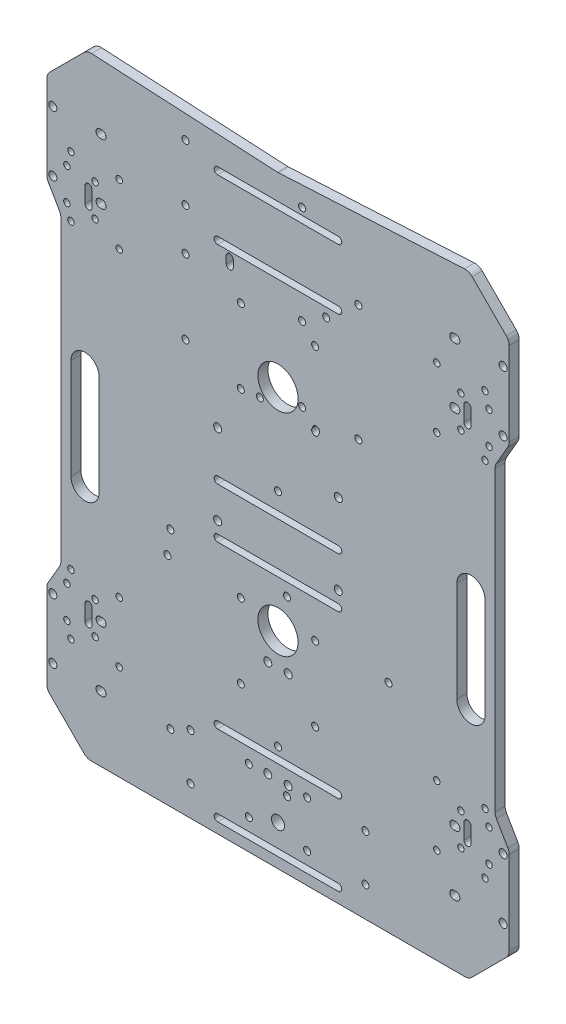
from build123d import *

# Parameters (mm, degrees)
F_5MM_DEPTH = 5


with BuildPart() as part:
    # 草图1 → 亚克力板厚5mm (new body)
    with BuildSketch(Plane.XY):
        with BuildLine():
            Line((113.535533906, -133.964466094), (96.464466094, -151.035533906))
            ThreePointArc((96.464466094, -151.035533906), (94.84234935, -152.119397663), (92.928932188, -152.5))
            Line((92.928932188, -152.5), (-92.928932188, -152.5))
            ThreePointArc((-92.928932188, -152.5), (-94.84234935, -152.119397663), (-96.464466094, -151.035533906))
            Line((-96.464466094, -151.035533906), (-113.535533906, -133.964466094))
            ThreePointArc((-113.535533906, -133.964466094), (-114.619397663, -132.34234935), (-115, -130.428932188))
            Line((-115, -130.428932188), (-115, -88.839745962))
            ThreePointArc((-115, -88.839745962), (-114.829629131, -87.545650737), (-114.330127019, -86.339745962))
            Line((-114.330127019, -86.339745962), (-108.669872981, -76.535898385))
            ThreePointArc((-108.669872981, -76.535898385), (-108.170370869, -75.32999361), (-108, -74.035898385))
            Line((-108, -74.035898385), (-108, 74.035898385))
            ThreePointArc((-108, 74.035898385), (-108.170370869, 75.32999361), (-108.669872981, 76.535898385))
            Line((-108.669872981, 76.535898385), (-114.330127019, 86.339745962))
            ThreePointArc((-114.330127019, 86.339745962), (-114.829629131, 87.545650737), (-115, 88.839745962))
            Line((-115, 88.839745962), (-115, 130.428932188))
            ThreePointArc((-115, 130.428932188), (-114.619397663, 132.34234935), (-113.535533906, 133.964466094))
            Line((-113.535533906, 133.964466094), (-96.574593882, 150.925406118))
            ThreePointArc((-96.574593882, 150.925406118), (-94.952477138, 152.009269874), (-93.039059976, 152.389872212))
            ThreePointArc((-93.039059976, 152.389872212), (-92.907617467, 152.3881442), (-92.776265811, 152.382961358))
            Line((-92.776265811, 152.382961358), (-0.262794166, 147.513831272))
            ThreePointArc((-0.262794166, 147.513831272), (-0.13144251, 147.50864843), (0, 147.506920418))
            ThreePointArc((0, 147.506920418), (0.13144251, 147.50864843), (0.262794166, 147.513831272))
            Line((0.262794166, 147.513831272), (92.776265811, 152.382961358))
            ThreePointArc((92.776265811, 152.382961358), (94.830378812, 152.05797427), (96.574593882, 150.925406118))
            Line((96.574593882, 150.925406118), (113.535533906, 133.964466094))
            ThreePointArc((113.535533906, 133.964466094), (114.619397663, 132.34234935), (115, 130.428932188))
            Line((115, 130.428932188), (115, 88.839745962))
            ThreePointArc((115, 88.839745962), (114.829629131, 87.545650737), (114.330127019, 86.339745962))
            Line((114.330127019, 86.339745962), (108.669872981, 76.535898385))
            ThreePointArc((108.669872981, 76.535898385), (108.170370869, 75.32999361), (108, 74.035898385))
            Line((108, 74.035898385), (108, -74.035898385))
            ThreePointArc((108, -74.035898385), (108.170370869, -75.32999361), (108.669872981, -76.535898385))
            Line((108.669872981, -76.535898385), (114.330127019, -86.339745962))
            ThreePointArc((114.330127019, -86.339745962), (114.829629131, -87.545650737), (115, -88.839745962))
            Line((115, -88.839745962), (115, -130.428932188))
            ThreePointArc((115, -130.428932188), (114.619397663, -132.34234935), (113.535533906, -133.964466094))
        make_face()
        with BuildLine():
            Line((87.5, -88), (88.5, -88))
            ThreePointArc((88.5, -88), (90.5, -90), (88.5, -92))
            Line((88.5, -92), (87.5, -92))
            ThreePointArc((87.5, -92), (85.5, -90), (87.5, -88))
        make_face(mode=Mode.SUBTRACT)
        with BuildLine():
            Line((87.5, -118), (88.5, -118))
            ThreePointArc((88.5, -118), (90.5, -120), (88.5, -122))
            Line((88.5, -122), (87.5, -122))
            ThreePointArc((87.5, -122), (85.5, -120), (87.5, -118))
        make_face(mode=Mode.SUBTRACT)
        with BuildLine():
            Line((-87.5, -88), (-88.5, -88))
            ThreePointArc((-88.5, -88), (-90.5, -90), (-88.5, -92))
            Line((-88.5, -92), (-87.5, -92))
            ThreePointArc((-87.5, -92), (-85.5, -90), (-87.5, -88))
        make_face(mode=Mode.SUBTRACT)
        with BuildLine():
            Line((-87.5, -118), (-88.5, -118))
            ThreePointArc((-88.5, -118), (-90.5, -120), (-88.5, -122))
            Line((-88.5, -122), (-87.5, -122))
            ThreePointArc((-87.5, -122), (-85.5, -120), (-87.5, -118))
        make_face(mode=Mode.SUBTRACT)
        with BuildLine():
            Line((-87.5, 88), (-88.5, 88))
            ThreePointArc((-88.5, 88), (-90.5, 90), (-88.5, 92))
            Line((-88.5, 92), (-87.5, 92))
            ThreePointArc((-87.5, 92), (-85.5, 90), (-87.5, 88))
        make_face(mode=Mode.SUBTRACT)
        with BuildLine():
            Line((-87.5, 118), (-88.5, 118))
            ThreePointArc((-88.5, 118), (-90.5, 120), (-88.5, 122))
            Line((-88.5, 122), (-87.5, 122))
            ThreePointArc((-87.5, 122), (-85.5, 120), (-87.5, 118))
        make_face(mode=Mode.SUBTRACT)
        with BuildLine():
            Line((30, -26.75), (-30, -26.75))
            ThreePointArc((-30, -26.75), (-31.75, -25), (-30, -23.25))
            Line((-30, -23.25), (30, -23.25))
            ThreePointArc((30, -23.25), (31.75, -25), (30, -26.75))
        make_face(mode=Mode.SUBTRACT)
        with BuildLine():
            Line((30, 131.5), (-30, 131.5))
            ThreePointArc((-30, 131.5), (-31.75, 133.25), (-30, 135))
            Line((-30, 135), (30, 135))
            ThreePointArc((30, 135), (31.75, 133.25), (30, 131.5))
        make_face(mode=Mode.SUBTRACT)
        with BuildLine():
            Line((30, -147.25), (-30, -147.25))
            ThreePointArc((-30, -147.25), (-31.75, -145.5), (-30, -143.75))
            Line((-30, -143.75), (30, -143.75))
            ThreePointArc((30, -143.75), (31.75, -145.5), (30, -147.25))
        make_face(mode=Mode.SUBTRACT)
        with BuildLine():
            Line((30, 101.5), (-30, 101.5))
            ThreePointArc((-30, 101.5), (-31.75, 103.25), (-30, 105))
            Line((-30, 105), (30, 105))
            ThreePointArc((30, 105), (31.75, 103.25), (30, 101.5))
        make_face(mode=Mode.SUBTRACT)
        with BuildLine():
            Line((30, -1.75), (-30, -1.75))
            ThreePointArc((-30, -1.75), (-31.75, 0), (-30, 1.75))
            Line((-30, 1.75), (30, 1.75))
            ThreePointArc((30, 1.75), (31.75, 0), (30, -1.75))
        make_face(mode=Mode.SUBTRACT)
        with BuildLine():
            Line((30, -107.25), (-30, -107.25))
            ThreePointArc((-30, -107.25), (-31.75, -105.5), (-30, -103.75))
            Line((-30, -103.75), (30, -103.75))
            ThreePointArc((30, -103.75), (31.75, -105.5), (30, -107.25))
        make_face(mode=Mode.SUBTRACT)
        with BuildLine():
            Line((-25.75, 95.30797427), (-25.75, 98.80797427))
            ThreePointArc((-25.75, 98.80797427), (-25.237436867, 100.045411137), (-24, 100.55797427))
            ThreePointArc((-24, 100.55797427), (-22.762563133, 100.045411137), (-22.25, 98.80797427))
            Line((-22.25, 98.80797427), (-22.25, 95.30797427))
            ThreePointArc((-22.25, 95.30797427), (-24, 93.55797427), (-25.75, 95.30797427))
        make_face(mode=Mode.SUBTRACT)
        with BuildLine():
            Line((-89, 15), (-89, -35))
            ThreePointArc((-89, -35), (-96, -42), (-103, -35))
            Line((-103, -35), (-103, 15))
            ThreePointArc((-103, 15), (-100.949747468, 19.949747468), (-96, 22))
            ThreePointArc((-96, 22), (-91.050252532, 19.949747468), (-89, 15))
        make_face(mode=Mode.SUBTRACT)
        with BuildLine():
            Line((-96, -86.1), (-96, -93.9))
            ThreePointArc((-96, -93.9), (-94.25, -95.65), (-92.5, -93.9))
            Line((-92.5, -93.9), (-92.5, -86.1))
            ThreePointArc((-92.5, -86.1), (-93.012563133, -84.862563133), (-94.25, -84.35))
            ThreePointArc((-94.25, -84.35), (-95.487436867, -84.862563133), (-96, -86.1))
        make_face(mode=Mode.SUBTRACT)
        with BuildLine():
            Line((-96, 93.9), (-96, 86.1))
            ThreePointArc((-96, 86.1), (-94.25, 84.35), (-92.5, 86.1))
            Line((-92.5, 86.1), (-92.5, 93.9))
            ThreePointArc((-92.5, 93.9), (-93.012563133, 95.137436867), (-94.25, 95.65))
            ThreePointArc((-94.25, 95.65), (-95.487436867, 95.137436867), (-96, 93.9))
        make_face(mode=Mode.SUBTRACT)
        with BuildLine():
            Line((96, -86.1), (96, -93.9))
            ThreePointArc((96, -93.9), (94.25, -95.65), (92.5, -93.9))
            Line((92.5, -93.9), (92.5, -86.1))
            ThreePointArc((92.5, -86.1), (93.012563133, -84.862563133), (94.25, -84.35))
            ThreePointArc((94.25, -84.35), (95.487436867, -84.862563133), (96, -86.1))
        make_face(mode=Mode.SUBTRACT)
        with BuildLine():
            Line((96, 93.9), (96, 86.1))
            ThreePointArc((96, 86.1), (94.25, 84.35), (92.5, 86.1))
            Line((92.5, 86.1), (92.5, 93.9))
            ThreePointArc((92.5, 93.9), (93.012563133, 95.137436867), (94.25, 95.65))
            ThreePointArc((94.25, 95.65), (95.487436867, 95.137436867), (96, 93.9))
        make_face(mode=Mode.SUBTRACT)
        with BuildLine():
            Line((89, 15), (89, -35))
            ThreePointArc((89, -35), (96, -42), (103, -35))
            Line((103, -35), (103, 15))
            ThreePointArc((103, 15), (100.949747468, 19.949747468), (96, 22))
            ThreePointArc((96, 22), (91.050252532, 19.949747468), (89, 15))
        make_face(mode=Mode.SUBTRACT)
        with BuildLine():
            Line((87.5, 118), (88.5, 118))
            ThreePointArc((88.5, 118), (90.5, 120), (88.5, 122))
            Line((88.5, 122), (87.5, 122))
            ThreePointArc((87.5, 122), (85.5, 120), (87.5, 118))
        make_face(mode=Mode.SUBTRACT)
        with BuildLine():
            Line((87.5, 88), (88.5, 88))
            ThreePointArc((88.5, 88), (90.5, 90), (88.5, 92))
            Line((88.5, 92), (87.5, 92))
            ThreePointArc((87.5, 92), (85.5, 90), (87.5, 88))
        make_face(mode=Mode.SUBTRACT)
        with BuildLine():
            ThreePointArc((112, -118), (114, -120), (112, -122))
            ThreePointArc((112, -122), (110, -120), (112, -118))
        make_face(mode=Mode.SUBTRACT)
        with BuildLine():
            ThreePointArc((112, -88), (114, -90), (112, -92))
            ThreePointArc((112, -92), (110, -90), (112, -88))
        make_face(mode=Mode.SUBTRACT)
        with BuildLine():
            ThreePointArc((112, 122), (110, 120), (112, 118))
            ThreePointArc((112, 118), (114, 120), (112, 122))
        make_face(mode=Mode.SUBTRACT)
        with BuildLine():
            ThreePointArc((112, 92), (110, 90), (112, 88))
            ThreePointArc((112, 88), (114, 90), (112, 92))
        make_face(mode=Mode.SUBTRACT)
        with BuildLine():
            ThreePointArc((-112, 122), (-110, 120), (-112, 118))
            ThreePointArc((-112, 118), (-114, 120), (-112, 122))
        make_face(mode=Mode.SUBTRACT)
        with BuildLine():
            ThreePointArc((-112, 92), (-110, 90), (-112, 88))
            ThreePointArc((-112, 88), (-114, 90), (-112, 92))
        make_face(mode=Mode.SUBTRACT)
        with BuildLine():
            ThreePointArc((0, -129.25), (3.25, -132.5), (0, -135.75))
            ThreePointArc((0, -135.75), (-3.25, -132.5), (0, -129.25))
        make_face(mode=Mode.SUBTRACT)
        with BuildLine():
            ThreePointArc((55, -43.08), (56.75, -44.83), (55, -46.58))
            ThreePointArc((55, -46.58), (53.25, -44.83), (55, -43.08))
        make_face(mode=Mode.SUBTRACT)
        with BuildLine():
            ThreePointArc((0, 11.92), (1.75, 10.17), (0, 8.42))
            ThreePointArc((0, 8.42), (-1.75, 10.17), (0, 11.92))
        make_face(mode=Mode.SUBTRACT)
        with BuildLine():
            ThreePointArc((-55, -43.08), (-53.25, -44.83), (-55, -46.58))
            ThreePointArc((-55, -46.58), (-56.75, -44.83), (-55, -43.08))
        make_face(mode=Mode.SUBTRACT)
        with BuildLine():
            ThreePointArc((5.075, -63.9), (7.075, -65.9), (5.075, -67.9))
            ThreePointArc((5.075, -67.9), (3.075, -65.9), (5.075, -63.9))
        make_face(mode=Mode.SUBTRACT)
        with BuildLine():
            ThreePointArc((-5.075, -63.9), (-3.075, -65.9), (-5.075, -67.9))
            ThreePointArc((-5.075, -67.9), (-7.075, -65.9), (-5.075, -63.9))
        make_face(mode=Mode.SUBTRACT)
        with BuildLine():
            ThreePointArc((-5.075, -112.1), (-3.075, -114.1), (-5.075, -116.1))
            ThreePointArc((-5.075, -116.1), (-7.075, -114.1), (-5.075, -112.1))
        make_face(mode=Mode.SUBTRACT)
        with BuildLine():
            ThreePointArc((5.075, -112.1), (7.075, -114.1), (5.075, -116.1))
            ThreePointArc((5.075, -116.1), (3.075, -114.1), (5.075, -112.1))
        make_face(mode=Mode.SUBTRACT)
        with BuildLine():
            ThreePointArc((0, -98.08), (1.75, -99.83), (0, -101.58))
            ThreePointArc((0, -101.58), (-1.75, -99.83), (0, -98.08))
        make_face(mode=Mode.SUBTRACT)
        with BuildLine():
            ThreePointArc((-43.5, -112.75), (-41.75, -114.5), (-43.5, -116.25))
            ThreePointArc((-43.5, -116.25), (-45.25, -114.5), (-43.5, -112.75))
        make_face(mode=Mode.SUBTRACT)
        with BuildLine():
            ThreePointArc((43.5, -112.75), (45.25, -114.5), (43.5, -116.25))
            ThreePointArc((43.5, -116.25), (41.75, -114.5), (43.5, -112.75))
        make_face(mode=Mode.SUBTRACT)
        with BuildLine():
            ThreePointArc((-43.5, -135.75), (-41.75, -137.5), (-43.5, -139.25))
            ThreePointArc((-43.5, -139.25), (-45.25, -137.5), (-43.5, -135.75))
        make_face(mode=Mode.SUBTRACT)
        with BuildLine():
            ThreePointArc((43.5, -135.75), (45.25, -137.5), (43.5, -139.25))
            ThreePointArc((43.5, -139.25), (41.75, -137.5), (43.5, -135.75))
        make_face(mode=Mode.SUBTRACT)
        with BuildLine():
            ThreePointArc((14.5, -135.75), (16.25, -137.5), (14.5, -139.25))
            ThreePointArc((14.5, -139.25), (12.75, -137.5), (14.5, -135.75))
        make_face(mode=Mode.SUBTRACT)
        with BuildLine():
            ThreePointArc((-14.5, -112.75), (-12.75, -114.5), (-14.5, -116.25))
            ThreePointArc((-14.5, -116.25), (-16.25, -114.5), (-14.5, -112.75))
        make_face(mode=Mode.SUBTRACT)
        with BuildLine():
            ThreePointArc((14.5, -112.75), (16.25, -114.5), (14.5, -116.25))
            ThreePointArc((14.5, -116.25), (12.75, -114.5), (14.5, -112.75))
        make_face(mode=Mode.SUBTRACT)
        with BuildLine():
            ThreePointArc((-14.5, -135.75), (-12.75, -137.5), (-14.5, -139.25))
            ThreePointArc((-14.5, -139.25), (-16.25, -137.5), (-14.5, -135.75))
        make_face(mode=Mode.SUBTRACT)
        with BuildLine():
            ThreePointArc((-18.5, 80.25), (-20.25, 82), (-18.5, 83.75))
            ThreePointArc((-18.5, 83.75), (-16.75, 82), (-18.5, 80.25))
        make_face(mode=Mode.SUBTRACT)
        with BuildLine():
            ThreePointArc((-18.5, 43.25), (-20.25, 45), (-18.5, 46.75))
            ThreePointArc((-18.5, 46.75), (-16.75, 45), (-18.5, 43.25))
        make_face(mode=Mode.SUBTRACT)
        with BuildLine():
            ThreePointArc((18.5, 80.25), (16.75, 82), (18.5, 83.75))
            ThreePointArc((18.5, 83.75), (20.25, 82), (18.5, 80.25))
        make_face(mode=Mode.SUBTRACT)
        with BuildLine():
            ThreePointArc((-18.5, -83.75), (-16.75, -82), (-18.5, -80.25))
            ThreePointArc((-18.5, -80.25), (-20.25, -82), (-18.5, -83.75))
        make_face(mode=Mode.SUBTRACT)
        with BuildLine():
            ThreePointArc((18.5, -46.75), (20.25, -45), (18.5, -43.25))
            ThreePointArc((18.5, -43.25), (16.75, -45), (18.5, -46.75))
        make_face(mode=Mode.SUBTRACT)
        with BuildLine():
            ThreePointArc((-18.5, -46.75), (-16.75, -45), (-18.5, -43.25))
            ThreePointArc((-18.5, -43.25), (-20.25, -45), (-18.5, -46.75))
        make_face(mode=Mode.SUBTRACT)
        with BuildLine():
            ThreePointArc((18.5, -83.75), (20.25, -82), (18.5, -80.25))
            ThreePointArc((18.5, -80.25), (16.75, -82), (18.5, -83.75))
        make_face(mode=Mode.SUBTRACT)
        with BuildLine():
            ThreePointArc((17.258845931, 46.233708465), (17.826337962, 47.356056479), (19, 47.80797427))
            ThreePointArc((19, 47.80797427), (20.615779969, 46.73010156), (20.241154069, 44.824265805))
            ThreePointArc((20.241154069, 44.824265805), (19.673662038, 43.701917791), (18.5, 43.25))
            ThreePointArc((18.5, 43.25), (16.884220031, 44.327872711), (17.258845931, 46.233708465))
        make_face(mode=Mode.SUBTRACT)
        with BuildLine():
            ThreePointArc((-9, 47.80797427), (-7.25, 46.05797427), (-9, 44.30797427))
            ThreePointArc((-9, 44.30797427), (-10.75, 46.05797427), (-9, 47.80797427))
        make_face(mode=Mode.SUBTRACT)
        with BuildLine():
            ThreePointArc((24, 98.80797427), (25.75, 97.05797427), (24, 95.30797427))
            ThreePointArc((24, 95.30797427), (22.25, 97.05797427), (24, 98.80797427))
        make_face(mode=Mode.SUBTRACT)
        with BuildLine():
            ThreePointArc((0, -60), (10, -50), (0, -40))
            ThreePointArc((0, -40), (-10, -50), (0, -60))
        make_face(mode=Mode.SUBTRACT)
        with BuildLine():
            ThreePointArc((0, 45), (10, 55), (0, 65))
            ThreePointArc((0, 65), (-10, 55), (0, 45))
        make_face(mode=Mode.SUBTRACT)
        with BuildLine():
            ThreePointArc((-53.5, -31.25), (-51.75, -33), (-53.5, -34.75))
            ThreePointArc((-53.5, -34.75), (-55.25, -33), (-53.5, -31.25))
        make_face(mode=Mode.SUBTRACT)
        with BuildLine():
            ThreePointArc((4.5, -31.25), (6.25, -33), (4.5, -34.75))
            ThreePointArc((4.5, -34.75), (2.75, -33), (4.5, -31.25))
        make_face(mode=Mode.SUBTRACT)
        with BuildLine():
            ThreePointArc((4.5, -117.25), (6.25, -119), (4.5, -120.75))
            ThreePointArc((4.5, -120.75), (2.75, -119), (4.5, -117.25))
        make_face(mode=Mode.SUBTRACT)
        with BuildLine():
            ThreePointArc((-53.5, -117.25), (-51.75, -119), (-53.5, -120.75))
            ThreePointArc((-53.5, -120.75), (-55.25, -119), (-53.5, -117.25))
        make_face(mode=Mode.SUBTRACT)
        with BuildLine():
            ThreePointArc((12, 91.25), (13.75, 89.5), (12, 87.75))
            ThreePointArc((12, 87.75), (10.25, 89.5), (12, 91.25))
        make_face(mode=Mode.SUBTRACT)
        with BuildLine():
            ThreePointArc((-46, 91.25), (-44.25, 89.5), (-46, 87.75))
            ThreePointArc((-46, 87.75), (-47.75, 89.5), (-46, 91.25))
        make_face(mode=Mode.SUBTRACT)
        with BuildLine():
            ThreePointArc((12, 140.25), (13.75, 138.5), (12, 136.75))
            ThreePointArc((12, 136.75), (10.25, 138.5), (12, 140.25))
        make_face(mode=Mode.SUBTRACT)
        with BuildLine():
            ThreePointArc((-46, 140.25), (-44.25, 138.5), (-46, 136.75))
            ThreePointArc((-46, 136.75), (-47.75, 138.5), (-46, 140.25))
        make_face(mode=Mode.SUBTRACT)
        with BuildLine():
            ThreePointArc((40, 54.25), (41.75, 52.5), (40, 50.75))
            ThreePointArc((40, 50.75), (38.25, 52.5), (40, 54.25))
        make_face(mode=Mode.SUBTRACT)
        with BuildLine():
            ThreePointArc((-46, 112.25), (-44.25, 110.5), (-46, 108.75))
            ThreePointArc((-46, 108.75), (-47.75, 110.5), (-46, 112.25))
        make_face(mode=Mode.SUBTRACT)
        with BuildLine():
            ThreePointArc((40, 112.25), (41.75, 110.5), (40, 108.75))
            ThreePointArc((40, 108.75), (38.25, 110.5), (40, 112.25))
        make_face(mode=Mode.SUBTRACT)
        with BuildLine():
            ThreePointArc((12, 54.25), (13.75, 52.5), (12, 50.75))
            ThreePointArc((12, 50.75), (10.25, 52.5), (12, 54.25))
        make_face(mode=Mode.SUBTRACT)
        with BuildLine():
            ThreePointArc((-46, 54.25), (-44.25, 52.5), (-46, 50.75))
            ThreePointArc((-46, 50.75), (-47.75, 52.5), (-46, 54.25))
        make_face(mode=Mode.SUBTRACT)
        with BuildLine():
            ThreePointArc((30, -15.5), (32, -17.5), (30, -19.5))
            ThreePointArc((30, -19.5), (28, -17.5), (30, -15.5))
        make_face(mode=Mode.SUBTRACT)
        with BuildLine():
            ThreePointArc((-30, 24.5), (-28, 22.5), (-30, 20.5))
            ThreePointArc((-30, 20.5), (-32, 22.5), (-30, 24.5))
        make_face(mode=Mode.SUBTRACT)
        with BuildLine():
            ThreePointArc((30, 24.5), (32, 22.5), (30, 20.5))
            ThreePointArc((30, 20.5), (28, 22.5), (30, 24.5))
        make_face(mode=Mode.SUBTRACT)
        with BuildLine():
            ThreePointArc((-30, -15.5), (-28, -17.5), (-30, -19.5))
            ThreePointArc((-30, -19.5), (-32, -17.5), (-30, -15.5))
        make_face(mode=Mode.SUBTRACT)
        with BuildLine():
            ThreePointArc((-91, -96.4), (-92.6, -98), (-91, -99.6))
            ThreePointArc((-91, -99.6), (-89.4, -98), (-91, -96.4))
        make_face(mode=Mode.SUBTRACT)
        with BuildLine():
            ThreePointArc((-91, -80.4), (-92.6, -82), (-91, -83.6))
            ThreePointArc((-91, -83.6), (-89.4, -82), (-91, -80.4))
        make_face(mode=Mode.SUBTRACT)
        with BuildLine():
            ThreePointArc((-105, -80.4), (-106.6, -82), (-105, -83.6))
            ThreePointArc((-105, -83.6), (-103.4, -82), (-105, -80.4))
        make_face(mode=Mode.SUBTRACT)
        with BuildLine():
            ThreePointArc((-79, -103.4), (-80.6, -105), (-79, -106.6))
            ThreePointArc((-79, -106.6), (-77.4, -105), (-79, -103.4))
        make_face(mode=Mode.SUBTRACT)
        with BuildLine():
            ThreePointArc((-103, -73.4), (-104.6, -75), (-103, -76.6))
            ThreePointArc((-103, -76.6), (-101.4, -75), (-103, -73.4))
        make_face(mode=Mode.SUBTRACT)
        with BuildLine():
            ThreePointArc((-103, -103.4), (-104.6, -105), (-103, -106.6))
            ThreePointArc((-103, -106.6), (-101.4, -105), (-103, -103.4))
        make_face(mode=Mode.SUBTRACT)
        with BuildLine():
            ThreePointArc((-105, -96.4), (-106.6, -98), (-105, -99.6))
            ThreePointArc((-105, -99.6), (-103.4, -98), (-105, -96.4))
        make_face(mode=Mode.SUBTRACT)
        with BuildLine():
            ThreePointArc((-79, -73.4), (-80.6, -75), (-79, -76.6))
            ThreePointArc((-79, -76.6), (-77.4, -75), (-79, -73.4))
        make_face(mode=Mode.SUBTRACT)
        with BuildLine():
            ThreePointArc((-91, 83.6), (-92.6, 82), (-91, 80.4))
            ThreePointArc((-91, 80.4), (-89.4, 82), (-91, 83.6))
        make_face(mode=Mode.SUBTRACT)
        with BuildLine():
            ThreePointArc((-91, 99.6), (-92.6, 98), (-91, 96.4))
            ThreePointArc((-91, 96.4), (-89.4, 98), (-91, 99.6))
        make_face(mode=Mode.SUBTRACT)
        with BuildLine():
            ThreePointArc((-105, 99.6), (-106.6, 98), (-105, 96.4))
            ThreePointArc((-105, 96.4), (-103.4, 98), (-105, 99.6))
        make_face(mode=Mode.SUBTRACT)
        with BuildLine():
            ThreePointArc((-79, 76.6), (-80.6, 75), (-79, 73.4))
            ThreePointArc((-79, 73.4), (-77.4, 75), (-79, 76.6))
        make_face(mode=Mode.SUBTRACT)
        with BuildLine():
            ThreePointArc((-103, 106.6), (-104.6, 105), (-103, 103.4))
            ThreePointArc((-103, 103.4), (-101.4, 105), (-103, 106.6))
        make_face(mode=Mode.SUBTRACT)
        with BuildLine():
            ThreePointArc((-103, 76.6), (-104.6, 75), (-103, 73.4))
            ThreePointArc((-103, 73.4), (-101.4, 75), (-103, 76.6))
        make_face(mode=Mode.SUBTRACT)
        with BuildLine():
            ThreePointArc((-105, 83.6), (-106.6, 82), (-105, 80.4))
            ThreePointArc((-105, 80.4), (-103.4, 82), (-105, 83.6))
        make_face(mode=Mode.SUBTRACT)
        with BuildLine():
            ThreePointArc((-79, 106.6), (-80.6, 105), (-79, 103.4))
            ThreePointArc((-79, 103.4), (-77.4, 105), (-79, 106.6))
        make_face(mode=Mode.SUBTRACT)
        with BuildLine():
            ThreePointArc((91, -96.4), (92.6, -98), (91, -99.6))
            ThreePointArc((91, -99.6), (89.4, -98), (91, -96.4))
        make_face(mode=Mode.SUBTRACT)
        with BuildLine():
            ThreePointArc((91, -80.4), (92.6, -82), (91, -83.6))
            ThreePointArc((91, -83.6), (89.4, -82), (91, -80.4))
        make_face(mode=Mode.SUBTRACT)
        with BuildLine():
            ThreePointArc((105, -80.4), (106.6, -82), (105, -83.6))
            ThreePointArc((105, -83.6), (103.4, -82), (105, -80.4))
        make_face(mode=Mode.SUBTRACT)
        with BuildLine():
            ThreePointArc((79, -103.4), (80.6, -105), (79, -106.6))
            ThreePointArc((79, -106.6), (77.4, -105), (79, -103.4))
        make_face(mode=Mode.SUBTRACT)
        with BuildLine():
            ThreePointArc((103, -73.4), (104.6, -75), (103, -76.6))
            ThreePointArc((103, -76.6), (101.4, -75), (103, -73.4))
        make_face(mode=Mode.SUBTRACT)
        with BuildLine():
            ThreePointArc((103, -103.4), (104.6, -105), (103, -106.6))
            ThreePointArc((103, -106.6), (101.4, -105), (103, -103.4))
        make_face(mode=Mode.SUBTRACT)
        with BuildLine():
            ThreePointArc((105, -96.4), (106.6, -98), (105, -99.6))
            ThreePointArc((105, -99.6), (103.4, -98), (105, -96.4))
        make_face(mode=Mode.SUBTRACT)
        with BuildLine():
            ThreePointArc((79, -73.4), (80.6, -75), (79, -76.6))
            ThreePointArc((79, -76.6), (77.4, -75), (79, -73.4))
        make_face(mode=Mode.SUBTRACT)
        with BuildLine():
            ThreePointArc((91, 83.6), (92.6, 82), (91, 80.4))
            ThreePointArc((91, 80.4), (89.4, 82), (91, 83.6))
        make_face(mode=Mode.SUBTRACT)
        with BuildLine():
            ThreePointArc((91, 99.6), (92.6, 98), (91, 96.4))
            ThreePointArc((91, 96.4), (89.4, 98), (91, 99.6))
        make_face(mode=Mode.SUBTRACT)
        with BuildLine():
            ThreePointArc((105, 99.6), (106.6, 98), (105, 96.4))
            ThreePointArc((105, 96.4), (103.4, 98), (105, 99.6))
        make_face(mode=Mode.SUBTRACT)
        with BuildLine():
            ThreePointArc((79, 76.6), (80.6, 75), (79, 73.4))
            ThreePointArc((79, 73.4), (77.4, 75), (79, 76.6))
        make_face(mode=Mode.SUBTRACT)
        with BuildLine():
            ThreePointArc((103, 106.6), (104.6, 105), (103, 103.4))
            ThreePointArc((103, 103.4), (101.4, 105), (103, 106.6))
        make_face(mode=Mode.SUBTRACT)
        with BuildLine():
            ThreePointArc((103, 76.6), (104.6, 75), (103, 73.4))
            ThreePointArc((103, 73.4), (101.4, 75), (103, 76.6))
        make_face(mode=Mode.SUBTRACT)
        with BuildLine():
            ThreePointArc((105, 83.6), (106.6, 82), (105, 80.4))
            ThreePointArc((105, 80.4), (103.4, 82), (105, 83.6))
        make_face(mode=Mode.SUBTRACT)
        with BuildLine():
            ThreePointArc((79, 106.6), (80.6, 105), (79, 103.4))
            ThreePointArc((79, 103.4), (77.4, 105), (79, 106.6))
        make_face(mode=Mode.SUBTRACT)
        with BuildLine():
            ThreePointArc((-112, -88), (-114, -90), (-112, -92))
            ThreePointArc((-112, -92), (-110, -90), (-112, -88))
        make_face(mode=Mode.SUBTRACT)
        with BuildLine():
            ThreePointArc((-112, -118), (-114, -120), (-112, -122))
            ThreePointArc((-112, -122), (-110, -120), (-112, -118))
        make_face(mode=Mode.SUBTRACT)
    extrude(amount=F_5MM_DEPTH)


solid = part.part
